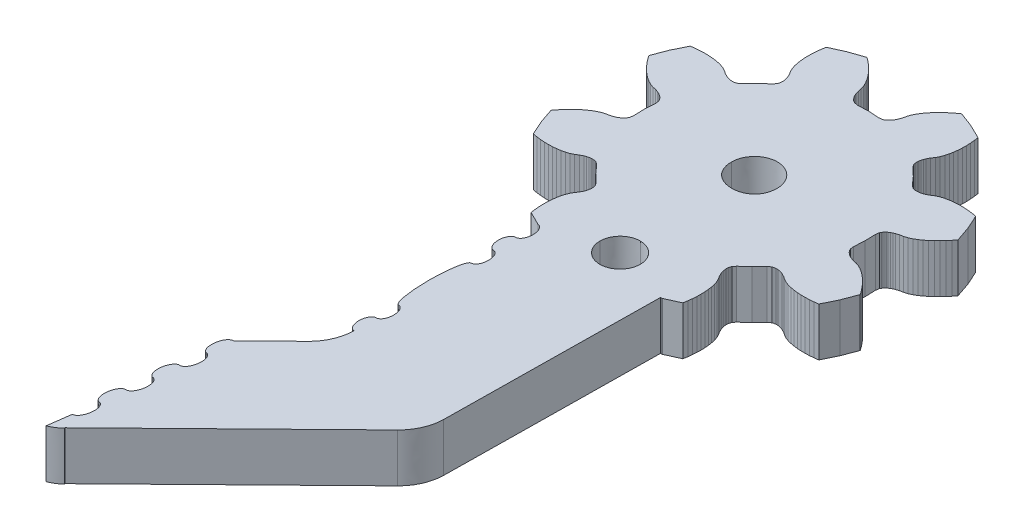
from build123d import *

# Parameters (mm, degrees)
BOSS_EXTRUDE1_DEPTH = 3.175


with BuildPart() as part:
    # Sketch1 → Boss-Extrude1 (new body)
    with BuildSketch(Plane(origin=(0, 0, 0), x_dir=(1, 0, 0), z_dir=(0, 1, 0))):
        with BuildLine():
            Line((2.642973005, 3.656156172), (2.739699001, 3.656156172))
            Line((2.739699001, 3.656156172), (3.679448299, 4.082171963))
            Line((3.679448299, 4.082171963), (3.726027296, 4.363724637))
            Line((3.726027296, 4.363724637), (3.758919204, 4.640989906))
            Line((3.758919204, 4.640989906), (3.778533466, 4.913264596))
            Line((3.778533466, 4.913264596), (3.78409019, 5.18016782))
            Line((3.78409019, 5.18016782), (3.77578435, 5.441045236))
            Line((3.77578435, 5.441045236), (3.753167507, 5.694695591))
            Line((3.753167507, 5.694695591), (3.715284296, 5.940728231))
            Line((3.715284296, 5.940728231), (3.661491306, 6.177160598))
            Line((3.661491306, 6.177160598), (3.588727465, 6.402137094))
            Line((3.588727465, 6.402137094), (3.486951675, 6.608040006))
            Line((3.486951675, 6.608040006), (3.363962845, 6.799986874))
            Line((3.363962845, 6.799986874), (3.263083929, 7.006788286))
            Line((3.263083929, 7.006788286), (3.223095012, 7.117127948))
            Line((3.223095012, 7.117127948), (3.19152892, 7.233805939))
            Line((3.19152892, 7.233805939), (3.171271248, 7.358043046))
            Line((3.171271248, 7.358043046), (3.166552907, 7.424483188))
            Line((3.166552907, 7.424483188), (3.166728382, 7.494312236))
            Line((3.166728382, 7.494312236), (3.173435446, 7.569258826))
            Line((3.173435446, 7.569258826), (3.190125116, 7.651950091))
            Line((3.190125116, 7.651950091), (3.225064238, 7.748851324))
            Line((3.225064238, 7.748851324), (3.364157818, 7.928834474))
            Line((3.364157818, 7.928834474), (3.89296299, 8.395106955))
            Line((3.89296299, 8.395106955), (4.374877208, 8.910025378))
            Line((4.374877208, 8.910025378), (4.55887302, 9.043726031))
            Line((4.55887302, 9.043726031), (4.656690863, 9.075476274))
            Line((4.656690863, 9.075476274), (4.739612786, 9.089617877))
            Line((4.739612786, 9.089617877), (4.814618814, 9.094159206))
            Line((4.814618814, 9.094159206), (4.884321583, 9.092176647))
            Line((4.884321583, 9.092176647), (4.950436852, 9.085262107))
            Line((4.950436852, 9.085262107), (5.073932611, 9.061139345))
            Line((5.073932611, 9.061139345), (5.189142026, 9.025931832))
            Line((5.189142026, 9.025931832), (5.29813181, 8.982217871))
            Line((5.29813181, 8.982217871), (5.501156964, 8.874817865))
            Line((5.501156964, 8.874817865), (5.688935248, 8.745785504))
            Line((5.688935248, 8.745785504), (5.891083026, 8.637301439))
            Line((5.891083026, 8.637301439), (6.113274005, 8.557481466))
            Line((6.113274005, 8.557481466), (6.347436312, 8.495973306))
            Line((6.347436312, 8.495973306), (6.591561729, 8.450472112))
            Line((6.591561729, 8.450472112), (6.844168462, 8.419815695))
            Line((6.844168462, 8.419815695), (7.103872204, 8.403300881))
            Line((7.103872204, 8.403300881), (7.370477982, 8.400546784))
            Line((7.370477982, 8.400546784), (7.642835457, 8.411426443))
            Line((7.642835457, 8.411426443), (7.920496192, 8.435744531))
            Line((7.920496192, 8.435744531), (8.202816776, 8.473510815))
            Line((8.202816776, 8.473510815), (8.657395811, 9.401123794))
            Line((8.657395811, 9.401123794), (9.021234514, 10.368173095))
            Line((9.021234514, 10.368173095), (8.855507652, 10.600191094))
            Line((8.855507652, 10.600191094), (8.683073726, 10.819532436))
            Line((8.683073726, 10.819532436), (8.504517655, 11.025816233))
            Line((8.504517655, 11.025816233), (8.32019039, 11.218729965))
            Line((8.32019039, 11.218729965), (8.130189416, 11.397238404))
            Line((8.130189416, 11.397238404), (7.935002167, 11.560511414))
            Line((7.935002167, 11.560511414), (7.734843112, 11.707650497))
            Line((7.734843112, 11.707650497), (7.529829235, 11.83662426))
            Line((7.529829235, 11.83662426), (7.31957059, 11.944219592))
            Line((7.31957059, 11.944219592), (7.102273427, 12.01769147))
            Line((7.102273427, 12.01769147), (6.879887475, 12.066532738))
            Line((6.879887475, 12.066532738), (6.662531821, 12.141284001))
            Line((6.662531821, 12.141284001), (6.556232662, 12.190828443))
            Line((6.556232662, 12.190828443), (6.451766247, 12.250861892))
            Line((6.451766247, 12.250861892), (6.349425035, 12.324529096))
            Line((6.349425035, 12.324529096), (6.299453512, 12.368057497))
            Line((6.299453512, 12.368057497), (6.250203388, 12.417592173))
            Line((6.250203388, 12.417592173), (6.202025614, 12.475643063))
            Line((6.202025614, 12.475643063), (6.15564159, 12.545852996))
            Line((6.15564159, 12.545852996), (6.111811709, 12.638916073))
            Line((6.111811709, 12.638916073), (6.083189705, 12.864791069))
            Line((6.083189705, 12.864791069), (6.127916461, 13.569156188))
            Line((6.127916461, 13.569156188), (6.105299618, 14.274556534))
            Line((6.105299618, 14.274556534), (6.141018631, 14.499533031))
            Line((6.141018631, 14.499533031), (6.187714612, 14.591121396))
            Line((6.187714612, 14.591121396), (6.236399315, 14.659856618))
            Line((6.236399315, 14.659856618), (6.286234357, 14.716120275))
            Line((6.286234357, 14.716120275), (6.336966275, 14.764190006))
            Line((6.336966275, 14.764190006), (6.388380596, 14.806302293))
            Line((6.388380596, 14.806302293), (6.492847011, 14.876512227))
            Line((6.492847011, 14.876512227), (6.599165668, 14.933283731))
            Line((6.599165668, 14.933283731), (6.707122096, 14.979566229))
            Line((6.707122096, 14.979566229), (6.926583456, 15.047402951))
            Line((6.926583456, 15.047402951), (7.150451201, 15.089134353))
            Line((7.150451201, 15.089134353), (7.369912561, 15.155701457))
            Line((7.369912561, 15.155701457), (7.583427252, 15.256636171))
            Line((7.583427252, 15.256636171), (7.792477066, 15.37907628))
            Line((7.792477066, 15.37907628), (7.997100997, 15.519886799))
            Line((7.997100997, 15.519886799), (8.197396533, 15.677143768))
            Line((8.197396533, 15.677143768), (8.392642275, 15.849509204))
            Line((8.392642275, 15.849509204), (8.582955204, 16.036406896))
            Line((8.582955204, 16.036406896), (8.768042864, 16.237055538))
            Line((8.768042864, 16.237055538), (8.947125361, 16.45077149))
            Line((8.947125361, 16.45077149), (9.120066216, 16.677408257))
            Line((9.120066216, 16.677408257), (8.786701759, 17.655454412))
            Line((8.786701759, 17.655454412), (8.361466127, 18.5970918))
            Line((8.361466127, 18.5970918), (8.080607839, 18.643559857))
            Line((8.080607839, 18.643559857), (7.803843979, 18.676716447))
            Line((7.803843979, 18.676716447), (7.531876449, 18.696170917))
            Line((7.531876449, 18.696170917), (7.265446146, 18.701806073))
            Line((7.265446146, 18.701806073), (7.005176984, 18.693416821))
            Line((7.005176984, 18.693416821), (6.751848852, 18.670759004))
            Line((6.751848852, 18.670759004), (6.506456112, 18.633002486))
            Line((6.506456112, 18.633002486), (6.270441562, 18.578975312))
            Line((6.270441562, 18.578975312), (6.045871915, 18.506206608))
            Line((6.045871915, 18.506206608), (5.840351109, 18.404051106))
            Line((5.840351109, 18.404051106), (5.648556386, 18.280849226))
            Line((5.648556386, 18.280849226), (5.442138705, 18.179973109))
            Line((5.442138705, 18.179973109), (5.331979084, 18.139716419))
            Line((5.331979084, 18.139716419), (5.215716816, 18.108161502))
            Line((5.215716816, 18.108161502), (5.091519156, 18.087808532))
            Line((5.091519156, 18.087808532), (5.025384389, 18.083071876))
            Line((5.025384389, 18.083071876), (4.955486648, 18.083267202))
            Line((4.955486648, 18.083267202), (4.880675592, 18.090171977))
            Line((4.880675592, 18.090171977), (4.798260599, 18.106882117))
            Line((4.798260599, 18.106882117), (4.701593095, 18.141698978))
            Line((4.701593095, 18.141698978), (4.521750203, 18.281230112))
            Line((4.521750203, 18.281230112), (4.056330682, 18.810993312))
            Line((4.056330682, 18.810993312), (3.542343442, 19.29358528))
            Line((3.542343442, 19.29358528), (3.40906005, 19.477924201))
            Line((3.40906005, 19.477924201), (3.377182, 19.575909493))
            Line((3.377182, 19.575909493), (3.363065971, 19.65899141))
            Line((3.363065971, 19.65899141), (3.358718078, 19.734133326))
            Line((3.358718078, 19.734133326), (3.360511828, 19.804147934))
            Line((3.360511828, 19.804147934), (3.367413864, 19.87020719))
            Line((3.367413864, 19.87020719), (3.391687975, 19.993926683))
            Line((3.391687975, 19.993926683), (3.42682207, 20.109325289))
            Line((3.42682207, 20.109325289), (3.470281503, 20.218512528))
            Line((3.470281503, 20.218512528), (3.577672509, 20.421925033))
            Line((3.577672509, 20.421925033), (3.706413035, 20.610033745))
            Line((3.706413035, 20.610033745), (3.814700917, 20.81273331))
            Line((3.814700917, 20.81273331), (3.894425286, 21.035151036))
            Line((3.894425286, 21.035151036), (3.955822215, 21.269913365))
            Line((3.955822215, 21.269913365), (4.001055899, 21.51448106))
            Line((4.001055899, 21.51448106), (4.031861598, 21.767418475))
            Line((4.031861598, 21.767418475), (4.048336798, 22.027729446))
            Line((4.048336798, 22.027729446), (4.050890942, 22.294622904))
            Line((4.050890942, 22.294622904), (4.040030958, 22.567473805))
            Line((4.040030958, 22.567473805), (4.015756847, 22.845637573))
            Line((4.015756847, 22.845637573), (3.978244084, 23.1284794))
            Line((3.978244084, 23.1284794), (3.052123383, 23.583872222))
            Line((3.052123383, 23.583872222), (2.086832651, 23.948370086))
            Line((2.086832651, 23.948370086), (1.855360967, 23.782342979))
            Line((1.855360967, 23.782342979), (1.636406536, 23.609665021))
            Line((1.636406536, 23.609665021), (1.4303788, 23.43076593))
            Line((1.4303788, 23.43076593), (1.237999159, 23.246055891))
            Line((1.237999159, 23.246055891), (1.059813536, 23.055700929))
            Line((1.059813536, 23.055700929), (0.896640817, 22.860365155))
            Line((0.896640817, 22.860365155), (0.749767823, 22.659833708))
            Line((0.749767823, 22.659833708), (0.621027297, 22.454321449))
            Line((0.621027297, 22.454321449), (0.513753274, 22.243808843))
            Line((0.513753274, 22.243808843), (0.44028753, 22.025932447))
            Line((0.44028753, 22.025932447), (0.391739308, 21.803133836))
            Line((0.391739308, 21.803133836), (0.317103729, 21.585589494))
            Line((0.317103729, 21.585589494), (0.267658632, 21.479087988))
            Line((0.267658632, 21.479087988), (0.207548524, 21.374246753))
            Line((0.207548524, 21.374246753), (0.134199764, 21.271905691))
            Line((0.134199764, 21.271905691), (0.090564856, 21.221658075))
            Line((0.090564856, 21.221658075), (0.04111976, 21.172504285))
            Line((0.04111976, 21.172504285), (-0.016650675, 21.124239228))
            Line((-0.016650675, 21.124239228), (-0.086723892, 21.077585611))
            Line((-0.086723892, 21.077585611), (-0.179823394, 21.033871651))
            Line((-0.179823394, 21.033871651), (-0.405270418, 21.005002467))
            Line((-0.405270418, 21.005002467), (-1.108381255, 21.049995813))
            Line((-1.108381255, 21.049995813), (-1.812486452, 21.027152436))
            Line((-1.812486452, 21.027152436), (-2.036861126, 21.063121721))
            Line((-2.036861126, 21.063121721), (-2.128478835, 21.10971674))
            Line((-2.128478835, 21.10971674), (-2.197109254, 21.158548242))
            Line((-2.197109254, 21.158548242), (-2.253261414, 21.208600532))
            Line((-2.253261414, 21.208600532), (-2.301244215, 21.259424359))
            Line((-2.301244215, 21.259424359), (-2.343085373, 21.310941594))
            Line((-2.343085373, 21.310941594), (-2.41337306, 21.415587503))
            Line((-2.41337306, 21.415587503), (-2.47003215, 21.522098775))
            Line((-2.47003215, 21.522098775), (-2.516221201, 21.630065226))
            Line((-2.516221201, 21.630065226), (-2.583954745, 21.849924181))
            Line((-2.583954745, 21.849924181), (-2.625405957, 22.074197504))
            Line((-2.625405957, 22.074197504), (-2.692047653, 22.294115057))
            Line((-2.692047653, 22.294115057), (-2.792790088, 22.508016568))
            Line((-2.792790088, 22.508016568), (-2.915018524, 22.71737675))
            Line((-2.915018524, 22.71737675), (-3.055379427, 22.922381162))
            Line((-3.055379427, 22.922381162), (-3.212352012, 23.123039571))
            Line((-3.212352012, 23.123039571), (-3.384590965, 23.318824595))
            Line((-3.384590965, 23.318824595), (-3.570965445, 23.509492078))
            Line((-3.570965445, 23.509492078), (-3.771260981, 23.694719732))
            Line((-3.771260981, 23.694719732), (-3.984775671, 23.874321997))
            Line((-3.984775671, 23.874321997), (-4.211002587, 24.047449204))
            Line((-4.211002587, 24.047449204), (-5.187289784, 23.713607757))
            Line((-5.187289784, 23.713607757), (-6.127214558, 23.287591967))
            Line((-6.127214558, 23.287591967), (-6.173598582, 23.006039292))
            Line((-6.173598582, 23.006039292), (-6.206685463, 22.728774023))
            Line((-6.206685463, 22.728774023), (-6.225929276, 22.456499334))
            Line((-6.225929276, 22.456499334), (-6.231544492, 22.189400784))
            Line((-6.231544492, 22.189400784), (-6.223375133, 21.928718693))
            Line((-6.223375133, 21.928718693), (-6.200563317, 21.674873013))
            Line((-6.200563317, 21.674873013), (-6.163050555, 21.429035698))
            Line((-6.163050555, 21.429035698), (-6.108945609, 21.192603332))
            Line((-6.108945609, 21.192603332), (-6.036298751, 20.967685433))
            Line((-6.036298751, 20.967685433), (-5.934327988, 20.761723924))
            Line((-5.934327988, 20.761723924), (-5.811534131, 20.569777055))
            Line((-5.811534131, 20.569777055), (-5.710655215, 20.362975644))
            Line((-5.710655215, 20.362975644), (-5.670666298, 20.252626215))
            Line((-5.670666298, 20.252626215), (-5.638983222, 20.136016588))
            Line((-5.638983222, 20.136016588), (-5.618842534, 20.011525557))
            Line((-5.618842534, 20.011525557), (-5.614124192, 19.945280741))
            Line((-5.614124192, 19.945280741), (-5.614319165, 19.875451693))
            Line((-5.614319165, 19.875451693), (-5.621026229, 19.800309778))
            Line((-5.621026229, 19.800309778), (-5.637696401, 19.717813838))
            Line((-5.637696401, 19.717813838), (-5.672655021, 19.620902839))
            Line((-5.672655021, 19.620902839), (-5.811729104, 19.440929455))
            Line((-5.811729104, 19.440929455), (-6.340534276, 18.974461648))
            Line((-6.340534276, 18.974461648), (-6.822448494, 18.459738551))
            Line((-6.822448494, 18.459738551), (-7.006444306, 18.326037899))
            Line((-7.006444306, 18.326037899), (-7.104067176, 18.294287656))
            Line((-7.104067176, 18.294287656), (-7.186989099, 18.280146053))
            Line((-7.186989099, 18.280146053), (-7.2621901, 18.275594957))
            Line((-7.2621901, 18.275594957), (-7.331892869, 18.277577516))
            Line((-7.331892869, 18.277577516), (-7.398027635, 18.284306497))
            Line((-7.398027635, 18.284306497), (-7.521523394, 18.308624585))
            Line((-7.521523394, 18.308624585), (-7.636713312, 18.343822332))
            Line((-7.636713312, 18.343822332), (-7.745508123, 18.387546059))
            Line((-7.745508123, 18.387546059), (-7.948747748, 18.494936298))
            Line((-7.948747748, 18.494936298), (-8.13638955, 18.623978425))
            Line((-8.13638955, 18.623978425), (-8.338849284, 18.73246249))
            Line((-8.338849284, 18.73246249), (-8.560864788, 18.812272697))
            Line((-8.560864788, 18.812272697), (-8.795007598, 18.873780858))
            Line((-8.795007598, 18.873780858), (-9.039133015, 18.919291817))
            Line((-9.039133015, 18.919291817), (-9.291622764, 18.949948234))
            Line((-9.291622764, 18.949948234), (-9.551638462, 18.966463048))
            Line((-9.551638462, 18.966463048), (-9.818068765, 18.969217145))
            Line((-9.818068765, 18.969217145), (-10.09042624, 18.958337487))
            Line((-10.09042624, 18.958337487), (-10.368086975, 18.934009632))
            Line((-10.368086975, 18.934009632), (-10.65040756, 18.896253115))
            Line((-10.65040756, 18.896253115), (-11.104967097, 17.968630369))
            Line((-11.104967097, 17.968630369), (-11.468825297, 17.001590834))
            Line((-11.468825297, 17.001590834), (-11.302903462, 16.769572835))
            Line((-11.302903462, 16.769572835), (-11.130723001, 16.550231494))
            Line((-11.130723001, 16.550231494), (-10.952147433, 16.343947697))
            Line((-10.952147433, 16.343947697), (-10.767566703, 16.151033964))
            Line((-10.767566703, 16.151033964), (-10.577760702, 15.972525525))
            Line((-10.577760702, 15.972525525), (-10.382573453, 15.809057189))
            Line((-10.382573453, 15.809057189), (-10.182414398, 15.661908341))
            Line((-10.182414398, 15.661908341), (-9.97726404, 15.53313967))
            Line((-9.97726404, 15.53313967), (-9.767200367, 15.425544338))
            Line((-9.767200367, 15.425544338), (-9.54986421, 15.352062694))
            Line((-9.54986421, 15.352062694), (-9.327458761, 15.303231191))
            Line((-9.327458761, 15.303231191), (-9.110103107, 15.228470162))
            Line((-9.110103107, 15.228470162), (-9.00386244, 15.178935486))
            Line((-9.00386244, 15.178935486), (-8.899337533, 15.118706711))
            Line((-8.899337533, 15.118706711), (-8.796996321, 15.045234833))
            Line((-8.796996321, 15.045234833), (-8.747024798, 15.001706432))
            Line((-8.747024798, 15.001706432), (-8.697774673, 14.951976431))
            Line((-8.697774673, 14.951976431), (-8.649791873, 14.894111101))
            Line((-8.649791873, 14.894111101), (-8.603212876, 14.823901167))
            Line((-8.603212876, 14.823901167), (-8.559382995, 14.73083809))
            Line((-8.559382995, 14.73083809), (-8.530644007, 14.504972861))
            Line((-8.530644007, 14.504972861), (-8.575546238, 13.800471014))
            Line((-8.575546238, 13.800471014), (-8.552870904, 13.095080433))
            Line((-8.552870904, 13.095080433), (-8.588589917, 12.870230899))
            Line((-8.588589917, 12.870230899), (-8.635285898, 12.778447208))
            Line((-8.635285898, 12.778447208), (-8.684029093, 12.709897545))
            Line((-8.684029093, 12.709897545), (-8.733805643, 12.653448329))
            Line((-8.733805643, 12.653448329), (-8.78453756, 12.605573924))
            Line((-8.78453756, 12.605573924), (-8.835971379, 12.563461637))
            Line((-8.835971379, 12.563461637), (-8.940418297, 12.493241937))
            Line((-8.940418297, 12.493241937), (-9.046736954, 12.436470432))
            Line((-9.046736954, 12.436470432), (-9.154712879, 12.390197701))
            Line((-9.154712879, 12.390197701), (-9.374154742, 12.322165652))
            Line((-9.374154742, 12.322165652), (-9.597847011, 12.28061981))
            Line((-9.597847011, 12.28061981), (-9.817542339, 12.213867147))
            Line((-9.817542339, 12.213867147), (-10.030881554, 12.113127758))
            Line((-10.030881554, 12.113127758), (-10.240048351, 11.990492324))
            Line((-10.240048351, 11.990492324), (-10.444691781, 11.84987713))
            Line((-10.444691781, 11.84987713), (-10.644772847, 11.692610395))
            Line((-10.644772847, 11.692610395), (-10.840408533, 11.520254725))
            Line((-10.840408533, 11.520254725), (-11.03074096, 11.333357034))
            Line((-11.03074096, 11.333357034), (-11.215633647, 11.132708392))
            Line((-11.215633647, 11.132708392), (-11.394774636, 10.918797114))
            Line((-11.394774636, 10.918797114), (-11.567715491, 10.69222871))
            Line((-11.567715491, 10.69222871), (-11.234468017, 9.714114191))
            Line((-11.234468017, 9.714114191), (-10.809037413, 8.77267213))
            Line((-10.809037413, 8.77267213), (-10.528179125, 8.726008746))
            Line((-10.528179125, 8.726008746), (-10.251298281, 8.693047482))
            Line((-10.251298281, 8.693047482), (-9.979447735, 8.673593012))
            Line((-9.979447735, 8.673593012), (-9.71303693, 8.667957857))
            Line((-9.71303693, 8.667957857), (-9.452806761, 8.676337342))
            Line((-9.452806761, 8.676337342), (-9.199420137, 8.698995159))
            Line((-9.199420137, 8.698995159), (-8.954027397, 8.736761443))
            Line((-8.954027397, 8.736761443), (-8.718032346, 8.790778851))
            Line((-8.718032346, 8.790778851), (-8.49352119, 8.863557321))
            Line((-8.49352119, 8.863557321), (-8.287727422, 8.965703057))
            Line((-8.287727422, 8.965703057), (-8.096322645, 9.088719377))
            Line((-8.096322645, 9.088719377), (-7.889904963, 9.189781054))
            Line((-7.889904963, 9.189781054), (-7.779569867, 9.230047511))
            Line((-7.779569867, 9.230047511), (-7.663346594, 9.261602427))
            Line((-7.663346594, 9.261602427), (-7.539090442, 9.281955397))
            Line((-7.539090442, 9.281955397), (-7.472780199, 9.286692053))
            Line((-7.472780199, 9.286692053), (-7.403077431, 9.286301401))
            Line((-7.403077431, 9.286301401), (-7.328266376, 9.279582186))
            Line((-7.328266376, 9.279582186), (-7.245714901, 9.262881813))
            Line((-7.245714901, 9.262881813), (-7.149183878, 9.228055185))
            Line((-7.149183878, 9.228055185), (-6.969321489, 9.088533818))
            Line((-6.969321489, 9.088533818), (-6.503901968, 8.558760852))
            Line((-6.503901968, 8.558760852), (-5.989914727, 8.075983323))
            Line((-5.989914727, 8.075983323), (-5.85645586, 7.891644403))
            Line((-5.85645586, 7.891644403), (-5.824772783, 7.79384467))
            Line((-5.824772783, 7.79384467), (-5.810637257, 7.710772519))
            Line((-5.810637257, 7.710772519), (-5.806308861, 7.635630604))
            Line((-5.806308861, 7.635630604), (-5.808083114, 7.56560623))
            Line((-5.808083114, 7.56560623), (-5.81498515, 7.49955674))
            Line((-5.81498515, 7.49955674), (-5.839259261, 7.375837246))
            Line((-5.839259261, 7.375837246), (-5.874412853, 7.260243314))
            Line((-5.874412853, 7.260243314), (-5.917852788, 7.151241635))
            Line((-5.917852788, 7.151241635), (-6.025048822, 6.947838897))
            Line((-6.025048822, 6.947838897), (-6.154042813, 6.759730184))
            Line((-6.154042813, 6.759730184), (-6.262330695, 6.557030619))
            Line((-6.262330695, 6.557030619), (-6.342016069, 6.334612894))
            Line((-6.342016069, 6.334612894), (-6.403412998, 6.099840798))
            Line((-6.403412998, 6.099840798), (-6.448705174, 5.855282869))
            Line((-6.448705174, 5.855282869), (-6.479296403, 5.602335688))
            Line((-6.479296403, 5.602335688), (-6.4957911, 5.342034483))
            Line((-6.4957911, 5.342034483), (-6.498462228, 5.074935933))
            Line((-6.498462228, 5.074935933), (-6.487797217, 4.802280358))
            Line((-6.487797217, 4.802280358), (-6.463328133, 4.52393103))
            Line((-6.463328133, 4.52393103), (-6.425834867, 4.24128453))
            Line((-6.425834867, 4.24128453), (-5.499694669, 3.785696381))
            Line((-5.499694669, 3.785696381), (-5.512933321, 3.785696381))
            add(Edge.make_bspline(
                [(-5.512933321, 3.785696381), (-5.285088131, 3.782629763), (-5.100526898, 3.453319879), (-5.100526898, 3.050352558)],
                knots=[324, 324, 324, 324, 325, 325, 325, 325], degree=3))
            add(Edge.make_bspline(
                [(-5.100526898, 3.050352558), (-5.100526898, 2.647248508), (-5.285088131, 2.32338822), (-5.512933321, 2.326464605)],
                knots=[325, 325, 325, 325, 326, 326, 326, 326], degree=3))
            add(Edge.make_bspline(
                [(-5.512933321, 2.326464605), (-5.74056404, 2.329531223), (-5.925125273, 2.005543973), (-5.925125273, 1.602576651)],
                knots=[326, 326, 326, 326, 327, 327, 327, 327], degree=3))
            add(Edge.make_bspline(
                [(-5.925125273, 1.602576651), (-5.925125273, 1.199599564), (-5.74056404, 0.870299446), (-5.512933321, 0.867037502)],
                knots=[327, 327, 327, 327, 328, 328, 328, 328], degree=3))
            add(Edge.make_bspline(
                [(-5.512933321, 0.867037502), (-5.285088131, 0.863765791), (-5.100526898, 0.534661), (-5.100526898, 0.131683912)],
                knots=[328, 328, 328, 328, 329, 329, 329, 329], degree=3))
            add(Edge.make_bspline(
                [(-5.100526898, 0.131683912), (-5.100526898, -0.271224812), (-5.285088131, -0.595465986), (-5.512933321, -0.592399367)],
                knots=[329, 329, 329, 329, 330, 330, 330, 330], degree=3))
            add(Edge.make_bspline(
                [(-5.512933321, -0.592399367), (-5.740759013, -0.582027556), (-5.925261754, -1.639063549), (-5.925261754, -2.953138803)],
                knots=[330, 330, 330, 330, 331, 331, 331, 331], degree=3))
            add(Edge.make_bspline(
                [(-5.925261754, -2.953138803), (-5.925261754, -4.267399616), (-5.740759014, -5.341135983), (-5.512933321, -5.351634756)],
                knots=[331, 331, 331, 331, 332, 332, 332, 332], degree=3))
            add(Edge.make_bspline(
                [(-5.512933321, -5.351634756), (-5.285283104, -5.3548967), (-5.100721871, -5.684011258), (-5.100721871, -6.087173906)],
                knots=[332, 332, 332, 332, 333, 333, 333, 333], degree=3))
            add(Edge.make_bspline(
                [(-5.100721871, -6.087173906), (-5.100721871, -6.489955667), (-5.285283104, -6.814138243), (-5.512933321, -6.810876299)],
                knots=[333, 333, 333, 333, 334, 334, 334, 334], degree=3))
            add(Edge.make_bspline(
                [(-5.512933321, -6.810876299), (-5.740759014, -6.807799915), (-5.925261755, -7.131855529), (-5.925261755, -7.534764252)],
                knots=[334, 334, 334, 334, 335, 335, 335, 335], degree=3))
            add(Edge.make_bspline(
                [(-5.925261755, -7.534764252), (-5.925261755, -7.937731574), (-5.740759014, -8.267041458), (-5.512933321, -8.270108076)],
                knots=[335, 335, 335, 335, 336, 336, 336, 336], degree=3))
            add(Edge.make_bspline(
                [(-5.512933321, -8.270108076), (-5.52289643, -9.065876), (-5.847955048, -9.824971466), (-6.41643718, -10.380527466)],
                knots=[336, 336, 336, 336, 337, 337, 337, 337], degree=3))
            Line((-6.41643718, -10.380527466), (-8.890836721, -12.798419291))
            add(Edge.make_bspline(
                [(-8.890836721, -12.798419291), (-9.11739509, -12.775185262), (-9.342354683, -13.108528628), (-9.393398556, -13.542669981)],
                knots=[338, 338, 338, 338, 339, 339, 339, 339], degree=3))
            add(Edge.make_bspline(
                [(-9.393398556, -13.542669981), (-9.44444243, -13.976996893), (-9.302092804, -14.347842852), (-9.075553932, -14.371076881)],
                knots=[339, 339, 339, 339, 340, 340, 340, 340], degree=3))
            add(Edge.make_bspline(
                [(-9.075553932, -14.371076881), (-8.848995562, -14.39431091), (-8.706840909, -14.765147103), (-8.757709307, -15.199298222)],
                knots=[340, 340, 340, 340, 341, 341, 341, 341], degree=3))
            add(Edge.make_bspline(
                [(-8.757709307, -15.199298222), (-8.808811673, -15.633625134), (-9.033888249, -15.966900135), (-9.260251646, -15.943724705)],
                knots=[341, 341, 341, 341, 342, 342, 342, 342], degree=3))
            add(Edge.make_bspline(
                [(-9.260251646, -15.943724705), (-9.486868507, -15.920490676), (-9.71175011, -16.253765678), (-9.762871973, -16.68790703)],
                knots=[342, 342, 342, 342, 343, 343, 343, 343], degree=3))
            add(Edge.make_bspline(
                [(-9.762871973, -16.68790703), (-9.813915847, -17.122243708), (-9.671566221, -17.493148266), (-9.445007851, -17.51631393)],
                knots=[343, 343, 343, 343, 344, 344, 344, 344], degree=3))
            add(Edge.make_bspline(
                [(-9.445007851, -17.51631393), (-9.218468979, -17.539547959), (-9.076255834, -17.910393918), (-9.127163227, -18.344535271)],
                knots=[344, 344, 344, 344, 345, 345, 345, 345], degree=3))
            add(Edge.make_bspline(
                [(-9.127163227, -18.344535271), (-9.178226597, -18.778930547), (-9.403361666, -19.112205549), (-9.629725062, -19.08897152)],
                knots=[345, 345, 345, 345, 346, 346, 346, 346], degree=3))
            add(Edge.make_bspline(
                [(-9.629725062, -19.08897152), (-9.856263934, -19.065737491), (-10.081223527, -19.399012493), (-10.132267401, -19.833407769)],
                knots=[346, 346, 346, 346, 347, 347, 347, 347], degree=3))
            add(Edge.make_bspline(
                [(-10.132267401, -19.833407769), (-10.183369766, -20.267549122), (-10.041039637, -20.638385315), (-9.814422776, -20.661619344)],
                knots=[347, 347, 347, 347, 348, 348, 348, 348], degree=3))
            add(Edge.make_bspline(
                [(-9.814422776, -20.661619344), (-9.587864407, -20.684853372), (-9.445534278, -21.055699332), (-9.496636643, -21.49003601)],
                knots=[348, 348, 348, 348, 349, 349, 349, 349], degree=3))
            add(Edge.make_bspline(
                [(-9.496636643, -21.49003601), (-9.547680517, -21.924177363), (-9.772640109, -22.257442598), (-9.999178982, -22.234208569)],
                knots=[349, 349, 349, 349, 350, 350, 350, 350], degree=3))
            Line((-9.999178982, -22.234208569), (-10.201268267, -23.738824344))
            Line((-10.201268267, -23.738824344), (-10.228603451, -23.738511823))
            add(Edge.make_bspline(
                [(-10.228603451, -23.738511823), (-10.229383342, -23.805586774), (-9.694748484, -23.521465562), (-9.456589234, -23.288881118)],
                knots=[352, 352, 352, 352, 353, 353, 353, 353], degree=3))
            Line((-9.456589234, -23.288881118), (-9.47037381, -23.242793946))
            Line((-9.47037381, -23.242793946), (1.543891951, -12.480194159))
            Line((1.543891951, -12.480194159), (1.545373744, -12.476736889))
            add(Edge.make_bspline(
                [(1.545373744, -12.476736889), (2.117228905, -11.924511198), (2.446518432, -11.167202965), (2.461024407, -10.371630366)],
                knots=[356, 356, 356, 356, 357, 357, 357, 357], degree=3))
            Line((2.461024407, -10.371630366), (2.642973005, 3.656156172))
        make_face()
        with BuildLine():
            add(Edge.make_bspline(
                [(-2.721059603, 13.674700597), (-2.721059603, 11.688264391), (0.273663793, 11.688264391), (0.273663793, 13.674515037)],
                knots=[2, 2, 2, 2, 3, 3, 3, 3], degree=3))
            add(Edge.make_bspline(
                [(0.273663793, 13.674515037), (0.273663793, 14.508557092), (-0.396964578, 15.184756201), (-1.223688156, 15.184756201), (-2.05080168, 15.184756201), (-2.721059603, 14.508557092), (-2.721059603, 13.674700597)],
                knots=[0, 0, 0, 0, 1, 1, 1, 2, 2, 2, 2], degree=3))
        make_face(mode=Mode.SUBTRACT)
        with BuildLine():
            add(Edge.make_bspline(
                [(-2.546130026, 4.891505279), (-2.555137769, 4.159804285), (-1.970550885, 3.55925494), (-1.240182854, 3.550035552)],
                knots=[3, 3, 3, 3, 4, 4, 4, 4], degree=3))
            add(Edge.make_bspline(
                [(-1.240182854, 3.550035552), (-0.509990299, 3.540943126), (0.089667981, 4.126774657), (0.098675723, 4.858348689)],
                knots=[0, 0, 0, 0, 1, 1, 1, 1], degree=3))
            add(Edge.make_bspline(
                [(0.098675723, 4.858348689), (0.107741958, 5.590176644), (-0.476825429, 6.190725989), (-1.207212957, 6.199818415)],
                knots=[1, 1, 1, 1, 2, 2, 2, 2], degree=3))
            add(Edge.make_bspline(
                [(-1.207212957, 6.199818415), (-1.937775961, 6.209037803), (-2.537044295, 5.62307931), (-2.546130026, 4.891505279)],
                knots=[2, 2, 2, 2, 3, 3, 3, 3], degree=3))
        make_face(mode=Mode.SUBTRACT)
    extrude(amount=BOSS_EXTRUDE1_DEPTH)


solid = part.part
